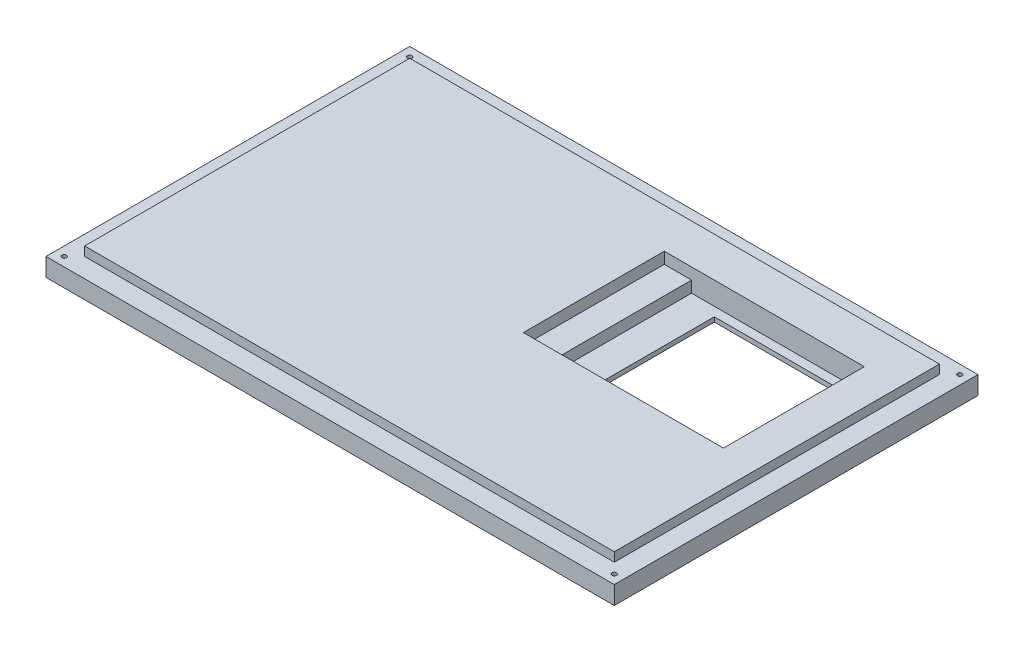
from build123d import *

# Parameters (mm, degrees)
BASE_SKETCH_W         = 125
BASE_SKETCH_H         = 80
BASE_EXTRUDE_DEPTH    = 4
INSET_SKETCH_W        = 116.5
INSET_SKETCH_H        = 71.5
INSET_EXTRUDE_DEPTH   = 2
INNER_HOLE_SKETCH_W   = 28
INNER_HOLE_SKETCH_H   = 27
INNER_HOLE_CUT_DEPTH  = 12
OUTER_HOLE_SKETCH_W   = 44
OUTER_HOLE_SKETCH_H   = 31
OUTTER_HOLE_CUT_DEPTH = 2.5
MIDDLE_HOLE_SKETCH_W  = 38
MIDDLE_HOLE_SKETCH_H  = 31
MIDDLE_HOLE_CUT_DEPTH = 5
F_1_0MM_DOWEL_HOLE1_D = 1


with BuildPart() as part:
    # base sketch → base extrude (new body)
    with BuildSketch(Plane(origin=(0, 0, 0), x_dir=(1, 0, 0), z_dir=(0, 1, 0))):
        with Locations((62.5, 40)):
            Rectangle(BASE_SKETCH_W, BASE_SKETCH_H)
    extrude(amount=BASE_EXTRUDE_DEPTH)

    # inset sketch → inset extrude (add)
    with BuildSketch(Plane(origin=(0, 4, 0), x_dir=(1, 0, 0), z_dir=(0, 1, 0))):
        with Locations((62.5, 40)):
            Rectangle(INSET_SKETCH_W, INSET_SKETCH_H)
    extrude(amount=INSET_EXTRUDE_DEPTH)

    # inner hole sketch → inner hole cut (cut)
    with BuildSketch(Plane(origin=(0, 6, 0), x_dir=(1, 0, 0), z_dir=(0, 1, 0))):
        with Locations((96, 51.5)):
            Rectangle(INNER_HOLE_SKETCH_W, INNER_HOLE_SKETCH_H)
    extrude(amount=-INNER_HOLE_CUT_DEPTH, mode=Mode.SUBTRACT)

    # outer hole sketch → outter hole cut (cut)
    with BuildSketch(Plane(origin=(0, 6, 0), x_dir=(1, 0, 0), z_dir=(0, 1, 0))):
        with Locations((91, 51.5)):
            Rectangle(OUTER_HOLE_SKETCH_W, OUTER_HOLE_SKETCH_H)
    extrude(amount=-OUTTER_HOLE_CUT_DEPTH, mode=Mode.SUBTRACT)

    # middle hole sketch → middle hole cut (cut)
    with BuildSketch(Plane(origin=(0, 6, 0), x_dir=(1, 0, 0), z_dir=(0, 1, 0))):
        with Locations((94, 51.5)):
            Rectangle(MIDDLE_HOLE_SKETCH_W, MIDDLE_HOLE_SKETCH_H)
    extrude(amount=-MIDDLE_HOLE_CUT_DEPTH, mode=Mode.SUBTRACT)

    # Ø1.0mm Dowel Hole1 (through all)
    with Locations(Plane(origin=(123, 0, -78), x_dir=(0, 0, -1), z_dir=(0, -1, 0))):
        with Locations((0, 0), (-76, 0), (-76, -121), (0, -121)):
            Hole(F_1_0MM_DOWEL_HOLE1_D / 2)


solid = part.part
